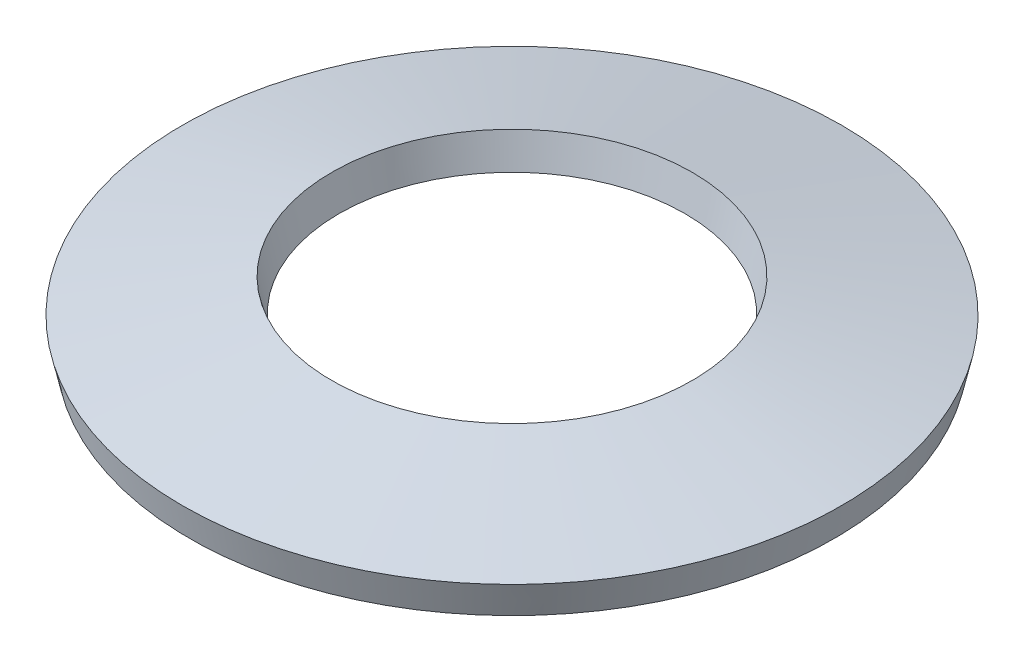
from build123d import *


with BuildPart() as part:
    # Sketch1 → Revolve1 (revolve)
    with BuildSketch(Plane.XY):
        Polygon((3.911740792, 0), (2.1, 0.4098586), (2.188259208, 0.8), (4, 0.3901414), align=None)
    revolve(axis=Axis((0, 0, 0), (0, 1, 0)))


solid = part.part
